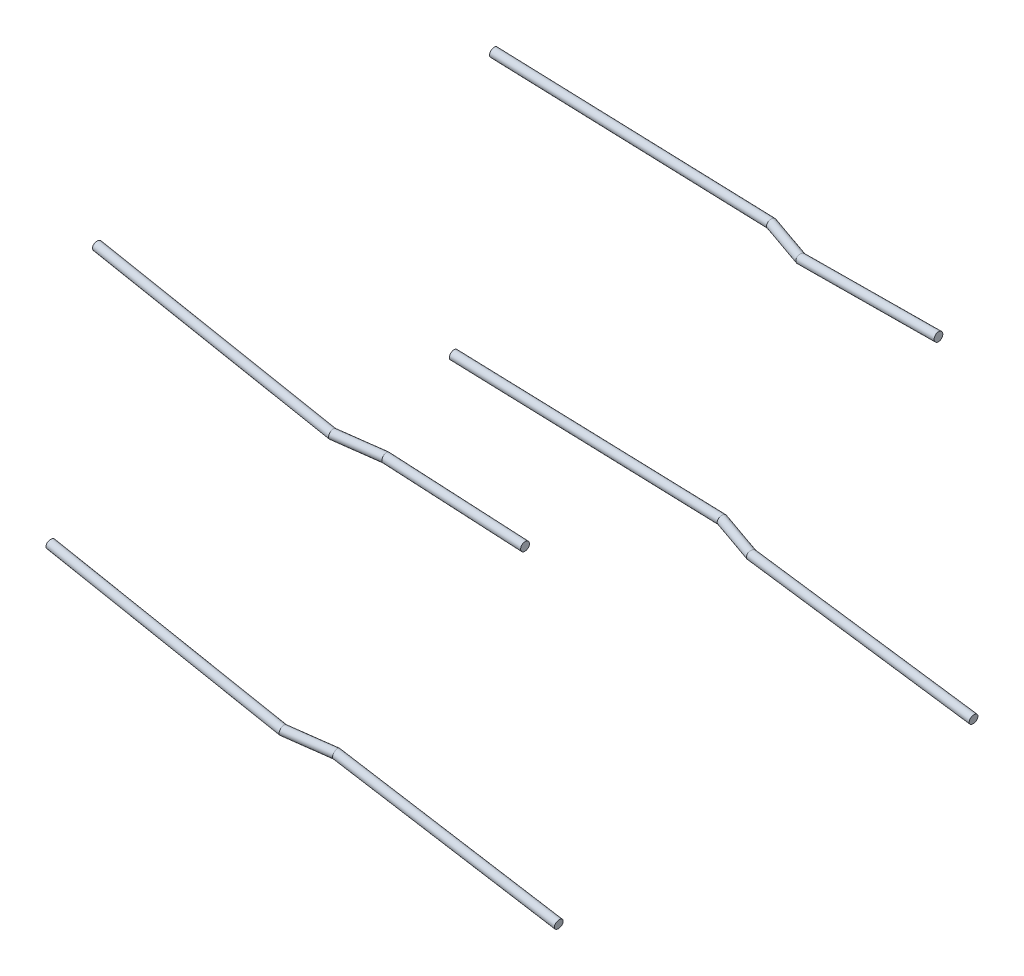
from build123d import *

# Parameters (mm, degrees)
SWEEP_1_PROFILE_R = 0.5
SWEEP_2_PROFILE_R = 0.5
SWEEP_3_PROFILE_R = 0.5
SWEEP_4_PROFILE_R = 0.5


with BuildPart() as part:
    # 扫描1: sweep along a curve in space
    with BuildLine() as sweep_1_path:
        Line((52.171085461, 60.842650367, 36.032668745), (82.031800547, 57.733121201, 34.020365643))
        Line((82.031800547, 57.733121201, 34.020365643), (86.811779566, 57.349259288, 35.436151859))
        Line((86.811779566, 57.349259288, 35.436151859), (102.481405378, 57.349259288, 35.307823101))
    # 扫描1 profile (on start of the path) → 扫描1 (sweep)
    with BuildSketch(Plane(origin=(52.171085461, 60.842650367, 36.032668745), x_dir=(0.10357438554911601, 0.9946217103291699, 0), z_dir=(0.9923949685878, -0.1033425050208269, -0.06687714839644278))):
        Circle(SWEEP_1_PROFILE_R)
    sweep(path=sweep_1_path.line, transition=Transition.RIGHT)


with BuildPart() as body_2:
    # 扫描2: sweep along a curve in space
    with BuildLine() as sweep_2_path:
        Line((50.094146041, 31.022171186, 38.567494979), (78.895946649, 28.004672299, 36.547369039))
        Line((78.895946649, 28.004672299, 36.547369039), (83.675925668, 27.620810386, 37.963155255))
        Line((109.355436502, 24.213192684, 38.155714127), (83.675925668, 27.620810386, 37.963155255))
    # 扫描2 profile (on start of the path) → 扫描2 (sweep)
    with BuildSketch(Plane(origin=(50.094146041, 31.022171186, 38.567494979), x_dir=(0.10419742757797212, 0.9945566329204856, 0), z_dir=(0.9921456467446154, -0.10394483406128718, -0.06958798112950629))):
        Circle(SWEEP_2_PROFILE_R)
    sweep(path=sweep_2_path.line, transition=Transition.RIGHT)


with BuildPart() as body_3:
    # 扫描3: sweep along a curve in space
    with BuildLine() as sweep_3_path:
        Line((49.735506476, 34.947362939, 84.399729522), (78.895946649, 32.285016295, 86.902658618))
        Line((78.895946649, 32.285016295, 86.902658618), (83.675925668, 31.667696631, 85.571975706))
        Line((83.675925668, 31.667696631, 85.571975706), (109.559212296, 27.843320909, 85.943660766))
    # 扫描3 profile (on start of the path) → 扫描3 (sweep)
    with BuildSketch(Plane(origin=(49.735506476, 34.947362939, 84.399729522), x_dir=(0.0909217860265156, 0.995858036481982, 0), z_dir=(0.992239780168551, -0.09059143941659012, 0.08516695224966031))):
        Circle(SWEEP_3_PROFILE_R)
    sweep(path=sweep_3_path.line, transition=Transition.RIGHT)


with BuildPart() as body_4:
    # 扫描4: sweep along a curve in space
    with BuildLine() as sweep_4_path:
        Line((52.529725026, 64.709621981, 81.869852167), (82.031800547, 62.013465198, 84.375655221))
        Line((82.031800547, 62.013465198, 84.375655221), (86.811779566, 61.396145534, 83.04497231))
        Line((86.811779566, 61.396145534, 83.04497231), (103.000566026, 60.75242454, 83.254592898))
    # 扫描4 profile (on start of the path) → 扫描4 (sweep)
    with BuildSketch(Plane(origin=(52.529725026, 64.709621981, 81.869852167), x_dir=(0.09100945482654034, 0.9958500284340891, 0), z_dir=(0.9923066478281535, -0.09068562982480165, 0.08428305416471385))):
        Circle(SWEEP_4_PROFILE_R)
    sweep(path=sweep_4_path.line, transition=Transition.RIGHT)


solid = Compound([part.part, body_2.part, body_3.part, body_4.part])
